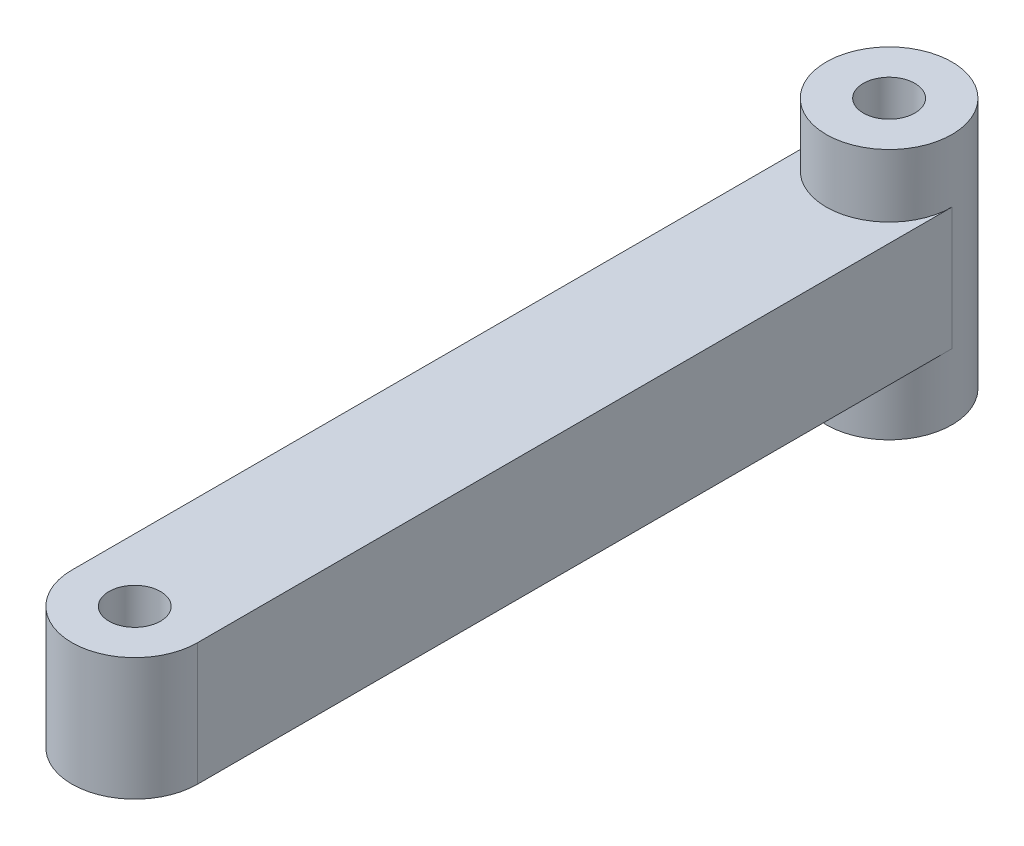
from build123d import *

# Parameters (mm, degrees)
ESQUISSE1_R             = 2.05
BOSS_EXTRU_1_DEPTH      = 9.75
BOSS_EXTRU_2_DEPTH      = 5
BOSS_EXTRU_2_DEPTH_BACK = 15
ESQUISSE2_R             = 5
ESQUISSE2_R_2           = 2.05


with BuildPart() as part:
    # Esquisse1 → Boss.-Extru.1 (new body)
    with BuildSketch(Plane(origin=(0, 0, 0), x_dir=(1, 0, 0), z_dir=(0, 1, 0))):
        with BuildLine():
            Line((-5, 0), (-5, 60))
            ThreePointArc((-5, 60), (0, 65), (5, 60))
            Line((5, 60), (5, 0))
            ThreePointArc((5, 0), (0, -5), (-5, 0))
        make_face()
        with Locations(Location((0, 60, 0), (0, 0, 270))):
            Circle(ESQUISSE1_R, mode=Mode.SUBTRACT)
        with Locations(Location((0, 0, 0), (0, 0, 270))):
            Circle(ESQUISSE1_R, mode=Mode.SUBTRACT)
    extrude(amount=BOSS_EXTRU_1_DEPTH)

    # Esquisse2 → Boss.-Extru.2 (add, two sides: drawn at the far end of the back side and taken through both)
    with BuildSketch(Plane(origin=(0, 9.75, 0), x_dir=(1, 0, 0), z_dir=(0, 1, 0)).offset(-BOSS_EXTRU_2_DEPTH_BACK)):
        with Locations(Location((0, 60, 0), (0, 0, 270))):
            Circle(ESQUISSE2_R)
        with Locations(Location((0, 60, 0), (0, 0, 270))):
            Circle(ESQUISSE2_R_2, mode=Mode.SUBTRACT)
    extrude(amount=BOSS_EXTRU_2_DEPTH + BOSS_EXTRU_2_DEPTH_BACK)


solid = part.part
